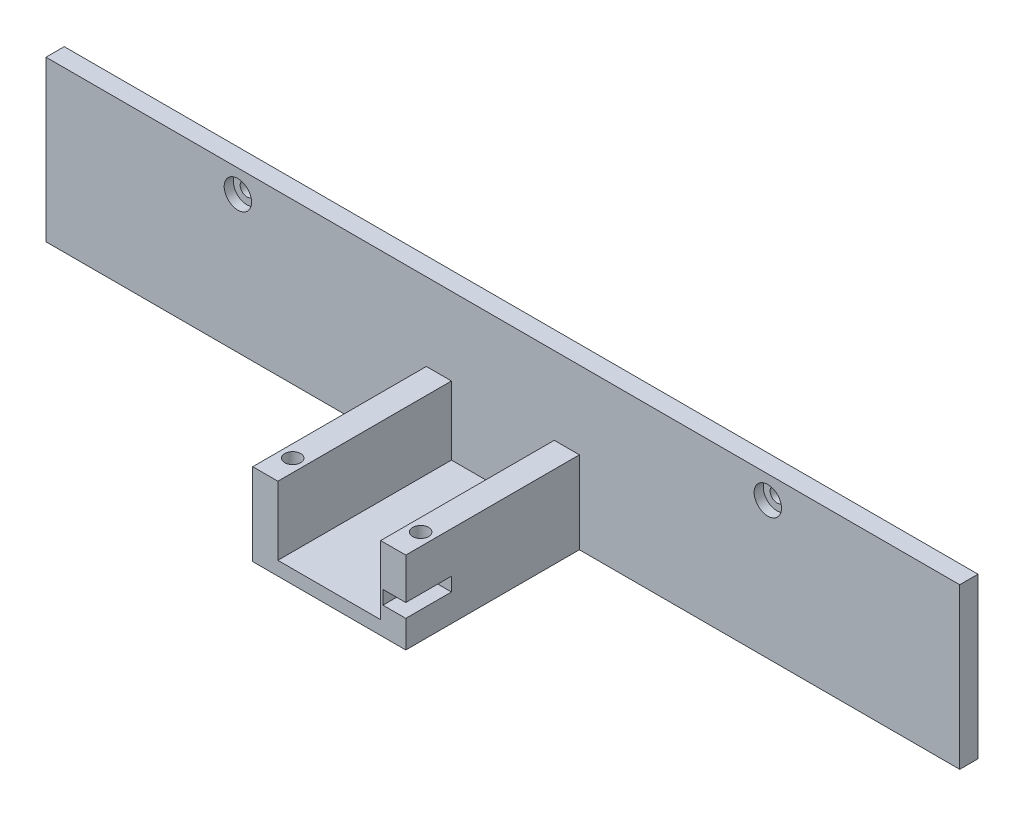
from build123d import *

# Parameters (mm, degrees)
SKETCH1_W           = 200
SKETCH1_H           = 35
SKETCH1_R           = 3
BODY_DEPTH          = 4
SKETCH1_3_R         = 3
SKETCH1_3_R_2       = 1.5
SCREW_INSERTS_DEPTH = 2
SERVO_INSERT_DEPTH  = 38
SKETCH3_W           = 5
SKETCH3_H           = 3
WIRE_CHANNEL_DEPTH  = 10
SKETCH4_R           = 1.75
M2X4X3_5_DEPTH      = 6


with BuildPart() as part:
    # Sketch1 → Body (new body)
    with BuildSketch(Plane.XY):
        with Locations((100, 17.5)):
            Rectangle(SKETCH1_W, SKETCH1_H)
        with Locations((158, 30)):
            Circle(SKETCH1_R, mode=Mode.SUBTRACT)
        with Locations((42, 30)):
            Circle(SKETCH1_R, mode=Mode.SUBTRACT)
    extrude(amount=BODY_DEPTH)

    # Sketch1<3> → Screw Inserts (add)
    # profile 1 of 2: a face of its own
    with BuildSketch(Plane.XY):
        with Locations((158, 30)):
            Circle(SKETCH1_3_R)
        with Locations((158, 30)):
            Circle(SKETCH1_3_R_2, mode=Mode.SUBTRACT)
    # profile 2 of 2: a face of its own
    with BuildSketch(Plane.XY):
        with Locations((42, 30)):
            Circle(SKETCH1_3_R)
        with Locations((42, 30)):
            Circle(SKETCH1_3_R_2, mode=Mode.SUBTRACT)
    extrude(amount=SCREW_INSERTS_DEPTH)

    # Sketch2 → Servo Insert (add)
    with BuildSketch(Plane.XY.offset(4)):
        Polygon((88.75, 18), (83.25, 18), (83.25, 0), (116.75, 0), (116.75, 18), (111.25, 18), (111.25, 3), (88.75, 3), align=None)
    extrude(amount=SERVO_INSERT_DEPTH)

    # Sketch3 → Wire Channel (cut)
    with BuildSketch(Plane.XY.offset(42)):
        with Locations((114.25, 7.5)):
            Rectangle(SKETCH3_W, SKETCH3_H)
    extrude(amount=-WIRE_CHANNEL_DEPTH, mode=Mode.SUBTRACT)

    # Sketch4 → M2x4x3.5 (cut)
    with BuildSketch(Plane(origin=(0, 18, 0), x_dir=(1, 0, 0), z_dir=(0, 1, 0))):
        with Locations((86, -36)):
            Circle(SKETCH4_R)
        with Locations((114, -36)):
            Circle(SKETCH4_R)
    extrude(amount=-M2X4X3_5_DEPTH, mode=Mode.SUBTRACT)


solid = part.part
